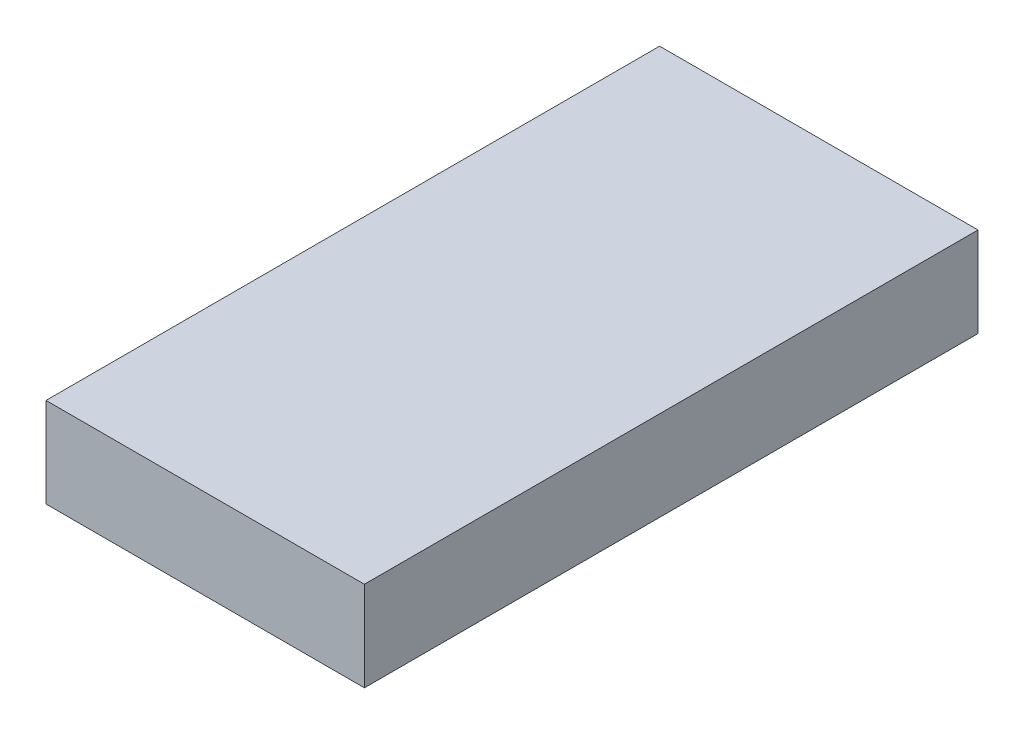
from build123d import *

# Parameters (mm, degrees)
SKETCH_1_W      = 44
SKETCH_1_H      = 84.8
EXTRUDE_1_DEPTH = 12.4


with BuildPart() as part:
    # 草图1 → 凸台-拉伸1 (new body)
    with BuildSketch(Plane(origin=(0, 0, 0), x_dir=(1, 0, 0), z_dir=(0, 1, 0))):
        Rectangle(SKETCH_1_W, SKETCH_1_H)
    extrude(amount=EXTRUDE_1_DEPTH)


solid = part.part
